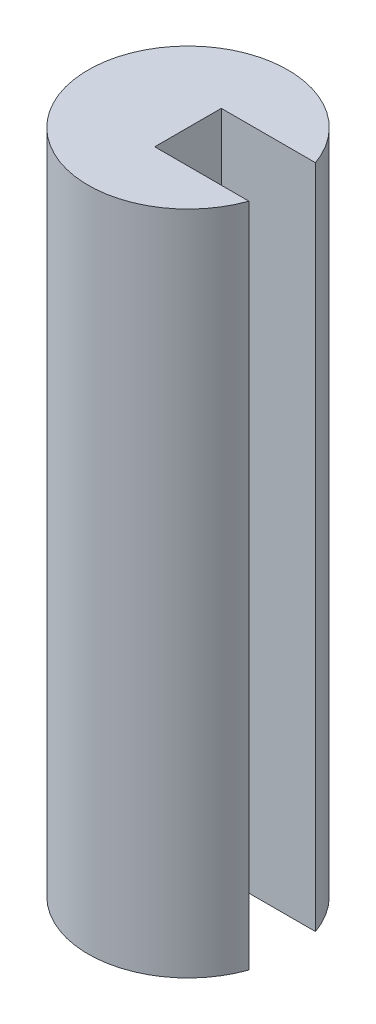
from build123d import *

# Parameters (mm, degrees)
SKETCH1_R                    = 1.5
BOSS_EXTRUDE1_DEPTH          = 10
CUT_EXTRUDE_THIN1_DEPTH      = 11.22252415
CUT_EXTRUDE_THIN1_DEPTH_BACK = 11.22252415
SKETCH2_W                    = 1.5
SKETCH2_H                    = 1


with BuildPart() as part:
    # Sketch1 → Boss-Extrude1 (new body)
    with BuildSketch(Plane(origin=(0, 0, 0), x_dir=(1, 0, 0), z_dir=(0, 1, 0))):
        Circle(SKETCH1_R)
    extrude(amount=BOSS_EXTRUDE1_DEPTH)

    # Sketch2 → Cut-Extrude-Thin1 (cut, two sides: drawn at the far end of the back side and taken through both)
    with BuildSketch(Plane(origin=(0, 10, 0), x_dir=(1, 0, 0), z_dir=(0, 1, 0)).offset(-CUT_EXTRUDE_THIN1_DEPTH_BACK)):
        with Locations((0.75, 0)):
            Rectangle(SKETCH2_W, SKETCH2_H)
    extrude(amount=CUT_EXTRUDE_THIN1_DEPTH + CUT_EXTRUDE_THIN1_DEPTH_BACK, mode=Mode.SUBTRACT)


solid = part.part
